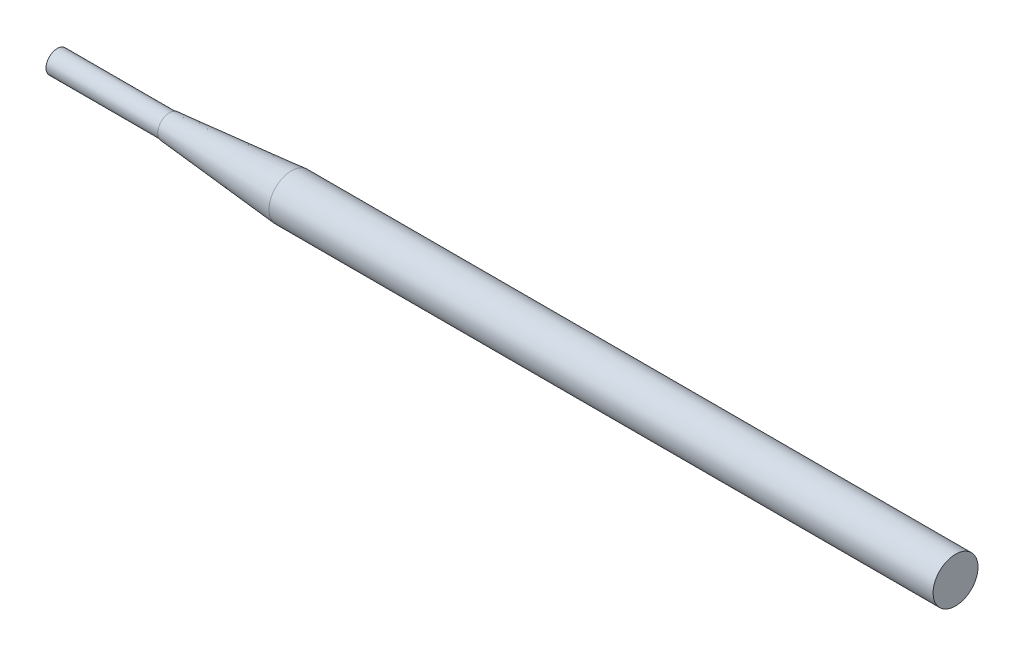
from build123d import *

# Parameters (mm, degrees)
SKETCH1_R           = 10
BOSS_EXTRUDE1_DEPTH = 100
SKETCH2_R           = 20
BOSS_EXTRUDE3_DEPTH = 700
SKETCH4_OUTSIDE_W   = 324.884
SKETCH4_OUTSIDE_H   = 324.884
SKETCH4_OUTSIDE_R   = 10.5
CUT_EXTRUDE2_DEPTH  = 700
CUT_EXTRUDE2_DRAFT  = -5


with BuildPart() as part:
    # Sketch1 → Boss-Extrude1 (new body)
    with BuildSketch(Plane(origin=(0, 0, 0), x_dir=(0, 0, -1), z_dir=(1, 0, 0))):
        Circle(SKETCH1_R)
    extrude(amount=BOSS_EXTRUDE1_DEPTH)

    # Sketch2 → Boss-Extrude3 (add)
    with BuildSketch(Plane(origin=(100, 0, 0), x_dir=(0, 0, -1), z_dir=(1, 0, 0))):
        Circle(SKETCH2_R)
    extrude(amount=BOSS_EXTRUDE3_DEPTH)


with BuildPart() as cut_extrude2_tool:
    # Sketch4 outside → Cut-Extrude2 (with draft: the straight prism first)
    with BuildSketch(Plane.ZY.offset(-100)):
        Rectangle(SKETCH4_OUTSIDE_W, SKETCH4_OUTSIDE_H)
        Circle(SKETCH4_OUTSIDE_R, mode=Mode.SUBTRACT)
    extrude(amount=-CUT_EXTRUDE2_DEPTH)
    # Cut-Extrude2: the draft: its side faces are tilted about the plane it starts from
    cut_extrude2_sides = [cut_extrude2_tool.faces().sort_by_distance(p)[0] for p in [
        (450, -162.442, 0),
        (450, 0, 162.442),
        (450, 162.442, 0),
        (450, 0, -162.442),
        (450, 0, -10.5),
    ]]
    draft(cut_extrude2_sides, Plane.ZY.offset(-100), CUT_EXTRUDE2_DRAFT)


with BuildPart() as part_1:
    add(part.part)

    # Cut-Extrude2: cut by cut_extrude2_tool
    add(cut_extrude2_tool.part, mode=Mode.SUBTRACT)


solid = part_1.part
